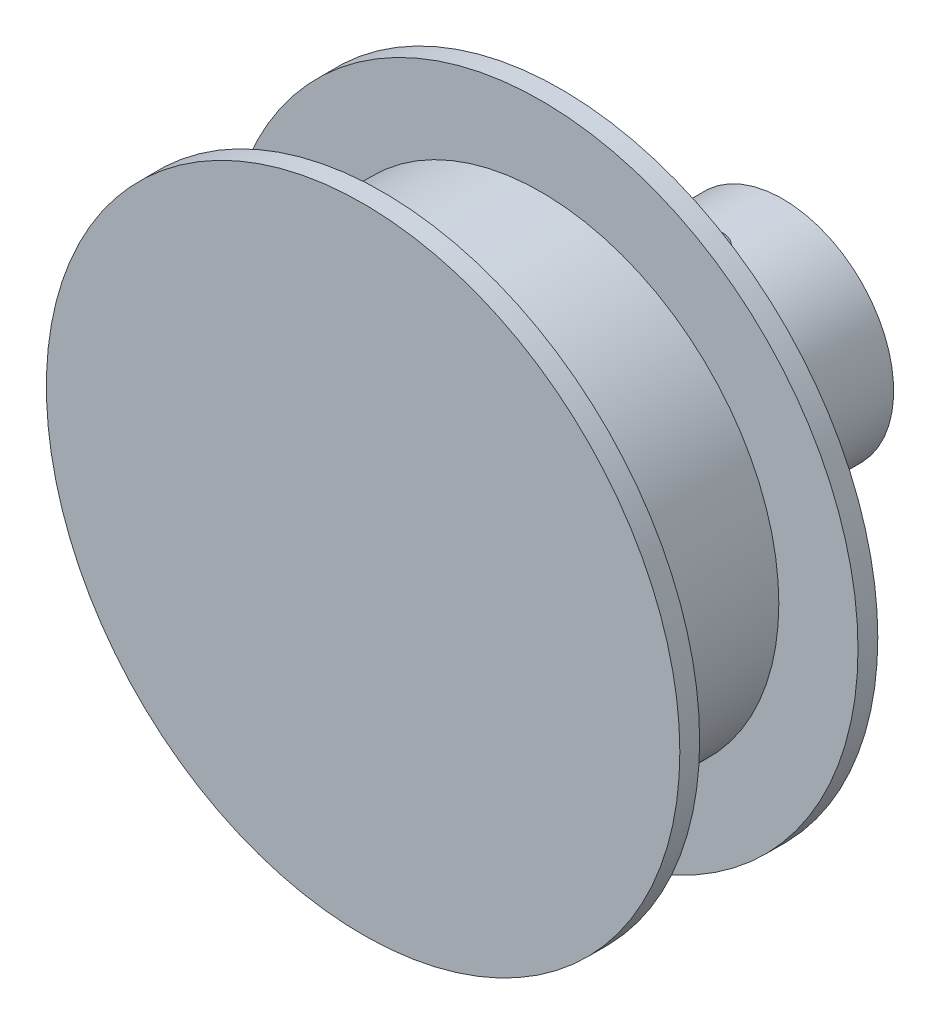
from build123d import *

# Parameters (mm, degrees)
SKETCH1_R               = 12.7
BOSS_EXTRUDE1_DEPTH     = 0.79375
SKETCH2_R               = 9.525
BOSS_EXTRUDE2_DEPTH     = 6.35
SKETCH3_R               = 12.7
BOSS_EXTRUDE3_DEPTH     = 0.79375
SKETCH4_R               = 4.445
BOSS_EXTRUDE4_DEPTH     = 8.89
SKETCH5_R               = 3.175
CUT_EXTRUDE1_DEPTH      = 9.525
CUT_EXTRUDE2_DEPTH      = 25.4
CUT_EXTRUDE2_DEPTH_BACK = 25.4
SKETCH6_R               = 0.7874


with BuildPart() as part:
    # Sketch1 → Boss-Extrude1 (new body)
    with BuildSketch(Plane.XY):
        Circle(SKETCH1_R)
    extrude(amount=BOSS_EXTRUDE1_DEPTH)

    # Sketch2 → Boss-Extrude2 (add)
    with BuildSketch(Plane.XY.offset(0.79375)):
        Circle(SKETCH2_R)
    extrude(amount=BOSS_EXTRUDE2_DEPTH)

    # Sketch3 → Boss-Extrude3 (add)
    with BuildSketch(Plane.XY.offset(7.14375)):
        Circle(SKETCH3_R)
    extrude(amount=BOSS_EXTRUDE3_DEPTH)

    # Sketch4 → Boss-Extrude4 (add)
    with BuildSketch(Plane(origin=(0, 0, 0), x_dir=(-1, 0, 0), z_dir=(0, 0, -1))):
        Circle(SKETCH4_R)
    extrude(amount=BOSS_EXTRUDE4_DEPTH)

    # Sketch5 → Cut-Extrude1 (cut)
    with BuildSketch(Plane(origin=(0, 0, -8.89), x_dir=(-1, 0, 0), z_dir=(0, 0, -1))):
        Circle(SKETCH5_R)
    extrude(amount=-CUT_EXTRUDE1_DEPTH, mode=Mode.SUBTRACT)

    # Sketch6 → Cut-Extrude2 (cut, two sides: drawn at the far end of the back side and taken through both)
    with BuildSketch(Plane(origin=(0, 0, 0), x_dir=(1, 0, 0), z_dir=(0, 1, 0)).offset(-CUT_EXTRUDE2_DEPTH_BACK)):
        with Locations((0, 5.715)):
            Circle(SKETCH6_R)
    extrude(amount=CUT_EXTRUDE2_DEPTH + CUT_EXTRUDE2_DEPTH_BACK, mode=Mode.SUBTRACT)


solid = part.part
